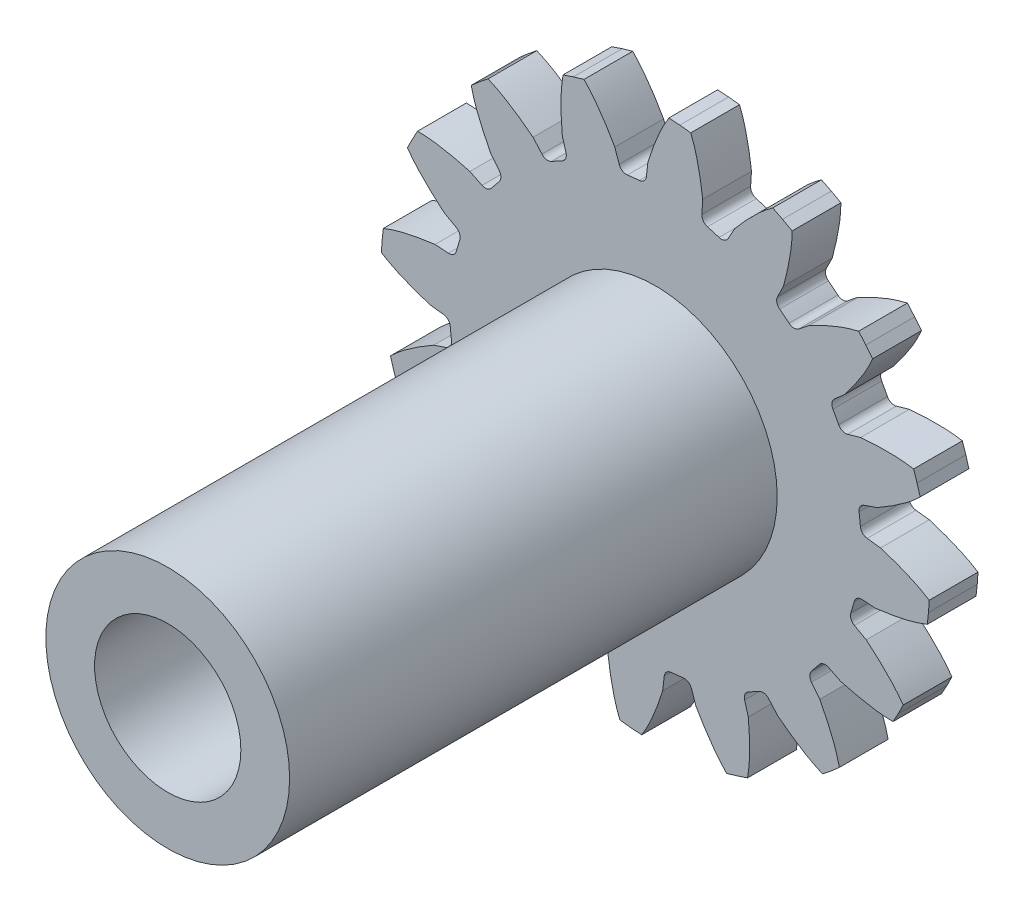
from build123d import *

# Parameters (mm, degrees)
BOSS_EXTRUDE1_DEPTH = 10
FILLET1_R           = 0.3125
SCALE1_SCALE_X      = 10
SCALE1_SCALE_Y      = 10
SCALE1_SCALE_Z      = 1
SKETCH5_R           = 50
BOSS_EXTRUDE2_DEPTH = 200
SKETCH15_R          = 30
CUT_EXTRUDE1_DEPTH  = 200


with BuildPart() as part:
    # Sketch2 → Boss-Extrude1 (new, symmetric)
    with BuildSketch(Plane.XY):
        with BuildLine():
            Line((-0.302623993, 9.238795325), (-0.396248786, 8.428190384))
            add(Edge.make_bspline(
                [(-1.398467591, 8.32079892), (-0.900663309, 8.404442545), (-0.396248786, 8.428190384)],
                knots=[0, 0, 0, 1, 1, 1], degree=2))
            Line((-1.398467591, 8.32079892), (-1.661713487, 9.093163842))
            add(Edge.make_bspline(
                [(-1.661713487, 9.093163842), (-2.020761764, 9.720213192), (-2.416112385, 10.344214849), (-2.925379163, 10.862994833)],
                knots=[0, 0, 0, 0, 1, 1, 1, 1], degree=3))
            Line((-2.925379163, 10.862994833), (-3.357860116, 10.737191227))
            Line((-3.357860116, 10.737191227), (-3.784958773, 10.594177037))
            add(Edge.make_bspline(
                [(-3.815122027, 8.419724719), (-3.877304002, 9.139613568), (-3.907915489, 9.87768072), (-3.784958773, 10.594177037)],
                knots=[0, 0, 0, 0, 1, 1, 1, 1], degree=3))
            Line((-3.815122027, 8.419724719), (-3.591414982, 7.634994744))
            add(Edge.make_bspline(
                [(-4.476247489, 7.152245434), (-4.048255538, 7.420072844), (-3.591414982, 7.634994744)],
                knots=[0, 0, 0, 1, 1, 1], degree=2))
            Line((-4.476247489, 7.152245434), (-5.015026238, 7.765077737))
            add(Edge.make_bspline(
                [(-5.015026238, 7.765077737), (-5.586438573, 8.207436933), (-6.190778664, 8.632151208), (-6.859786092, 8.916604442)],
                knots=[0, 0, 0, 0, 1, 1, 1, 1], degree=3))
            Line((-6.859786092, 8.916604442), (-7.211203432, 8.634873772))
            Line((-7.211203432, 8.634873772), (-7.551061976, 8.339302311))
            add(Edge.make_bspline(
                [(-6.746802312, 6.318827346), (-7.080223864, 6.959938712), (-7.390413769, 7.630305318), (-7.551061976, 8.339302311)],
                knots=[0, 0, 0, 0, 1, 1, 1, 1], degree=3))
            Line((-6.746802312, 6.318827346), (-6.239820787, 5.67944037))
            add(Edge.make_bspline(
                [(-6.872559268, 4.894827424), (-6.579703447, 5.305973173), (-6.239820787, 5.67944037)],
                knots=[0, 0, 0, 1, 1, 1], degree=2))
            Line((-6.872559268, 4.894827424), (-7.6048467, 5.25482894))
            add(Edge.make_bspline(
                [(-7.6048467, 5.25482894), (-8.302123015, 5.444334318), (-9.022913921, 5.606015014), (-9.749852755, 5.612741867)],
                knots=[0, 0, 0, 0, 1, 1, 1, 1], degree=3))
            Line((-9.749852755, 5.612741867), (-9.966706385, 5.217975069))
            Line((-9.966706385, 5.217975069), (-10.167584439, 4.814844409))
            add(Edge.make_bspline(
                [(-8.65134311, 3.255945788), (-9.204350686, 3.721014784), (-9.747888564, 4.221261479), (-10.167584439, 4.814844409)],
                knots=[0, 0, 0, 0, 1, 1, 1, 1], degree=3))
            Line((-8.65134311, 3.255945788), (-7.938270456, 2.85924267))
            add(Edge.make_bspline(
                [(-8.222586211, 1.892216293), (-8.10933276, 2.384234876), (-7.938270456, 2.85924267)],
                knots=[0, 0, 0, 1, 1, 1], degree=2))
            Line((-8.222586211, 1.892216293), (-9.036898195, 1.944580063))
            add(Edge.make_bspline(
                [(-9.036898195, 1.944580063), (-9.753742916, 1.853325712), (-10.481394233, 1.72631108), (-11.155592729, 1.454390203)],
                knots=[0, 0, 0, 0, 1, 1, 1, 1], degree=3))
            Line((-11.155592729, 1.454390203), (-11.204868646, 1.006686951))
            Line((-11.204868646, 1.006686951), (-11.236184343, 0.557370086))
            add(Edge.make_bspline(
                [(-9.238795342, -0.302624001), (-9.927894173, -0.085054444), (-10.621252328, 0.169628943), (-11.236184343, 0.557370086)],
                knots=[0, 0, 0, 0, 1, 1, 1, 1], degree=3))
            Line((-9.238795342, -0.302624001), (-8.428190401, -0.396248794))
            add(Edge.make_bspline(
                [(-8.320798937, -1.398467598), (-8.404442527, -0.900663312), (-8.428190401, -0.396248794)],
                knots=[0, 0, 0, 1, 1, 1], degree=2))
            Line((-8.320798937, -1.398467598), (-9.093163859, -1.661713495))
            add(Edge.make_bspline(
                [(-9.093163859, -1.661713495), (-9.720213202, -2.020761772), (-10.344214854, -2.416112389), (-10.862994833, -2.925379163)],
                knots=[0, 0, 0, 0, 1, 1, 1, 1], degree=3))
            Line((-10.862994833, -2.925379163), (-10.737191227, -3.357860116))
            Line((-10.737191227, -3.357860116), (-10.594177037, -3.784958773))
            add(Edge.make_bspline(
                [(-8.419724736, -3.815122035), (-9.13961358, -3.877304001), (-9.877680726, -3.907915488), (-10.594177037, -3.784958773)],
                knots=[0, 0, 0, 0, 1, 1, 1, 1], degree=3))
            Line((-8.419724736, -3.815122035), (-7.634994761, -3.59141499))
            add(Edge.make_bspline(
                [(-7.152245451, -4.476247497), (-7.420072829, -4.048255528), (-7.634994761, -3.59141499)],
                knots=[0, 0, 0, 1, 1, 1], degree=2))
            Line((-7.152245451, -4.476247497), (-7.765077754, -5.015026246))
            add(Edge.make_bspline(
                [(-7.765077754, -5.015026246), (-8.207436937, -5.586438584), (-8.63215121, -6.190778669), (-8.916604442, -6.859786092)],
                knots=[0, 0, 0, 0, 1, 1, 1, 1], degree=3))
            Line((-8.916604442, -6.859786092), (-8.634873772, -7.211203432))
            Line((-8.634873772, -7.211203432), (-8.339302311, -7.551061976))
            add(Edge.make_bspline(
                [(-6.318827363, -6.74680232), (-6.959938724, -7.08022387), (-7.630305324, -7.39041377), (-8.339302311, -7.551061976)],
                knots=[0, 0, 0, 0, 1, 1, 1, 1], degree=3))
            Line((-6.318827363, -6.74680232), (-5.679440387, -6.239820795))
            add(Edge.make_bspline(
                [(-4.894827441, -6.872559276), (-5.305973169, -6.579703429), (-5.679440387, -6.239820795)],
                knots=[0, 0, 0, 1, 1, 1], degree=2))
            Line((-4.894827441, -6.872559276), (-5.254828957, -7.604846708))
            add(Edge.make_bspline(
                [(-5.254828957, -7.604846708), (-5.444334315, -8.302123024), (-5.606015015, -9.022913925), (-5.612741867, -9.749852755)],
                knots=[0, 0, 0, 0, 1, 1, 1, 1], degree=3))
            Line((-5.612741867, -9.749852755), (-5.217975069, -9.966706385))
            Line((-5.217975069, -9.966706385), (-4.814844409, -10.167584439))
            add(Edge.make_bspline(
                [(-3.255945805, -8.651343118), (-3.72101479, -9.204350696), (-4.221261484, -9.747888567), (-4.814844409, -10.167584439)],
                knots=[0, 0, 0, 0, 1, 1, 1, 1], degree=3))
            Line((-3.255945805, -8.651343118), (-2.859242687, -7.938270464))
            add(Edge.make_bspline(
                [(-1.89221631, -8.222586219), (-2.384234886, -8.109332744), (-2.859242687, -7.938270464)],
                knots=[0, 0, 0, 1, 1, 1], degree=2))
            Line((-1.89221631, -8.222586219), (-1.94458008, -9.036898203))
            add(Edge.make_bspline(
                [(-1.94458008, -9.036898203), (-1.853325706, -9.753742918), (-1.72631108, -10.481394234), (-1.454390203, -11.155592729)],
                knots=[0, 0, 0, 0, 1, 1, 1, 1], degree=3))
            Line((-1.454390203, -11.155592729), (-1.006686951, -11.204868646))
            Line((-1.006686951, -11.204868646), (-0.557370086, -11.236184343))
            add(Edge.make_bspline(
                [(0.302623984, -9.23879535), (0.085054445, -9.927894182), (-0.169628946, -10.621252331), (-0.557370086, -11.236184343)],
                knots=[0, 0, 0, 0, 1, 1, 1, 1], degree=3))
            Line((0.302623984, -9.23879535), (0.396248777, -8.428190409))
            add(Edge.make_bspline(
                [(1.398467582, -8.320798945), (0.900663294, -8.404442523), (0.396248777, -8.428190409)],
                knots=[0, 0, 0, 1, 1, 1], degree=2))
            Line((1.398467582, -8.320798945), (1.661713478, -9.093163867))
            add(Edge.make_bspline(
                [(1.661713478, -9.093163867), (2.020761776, -9.720213198), (2.416112388, -10.344214853), (2.925379163, -10.862994833)],
                knots=[0, 0, 0, 0, 1, 1, 1, 1], degree=3))
            Line((2.925379163, -10.862994833), (3.357860116, -10.737191227))
            Line((3.357860116, -10.737191227), (3.784958773, -10.594177037))
            add(Edge.make_bspline(
                [(3.815122018, -8.419724743), (3.877304006, -9.139613584), (3.907915487, -9.877680728), (3.784958773, -10.594177037)],
                knots=[0, 0, 0, 0, 1, 1, 1, 1], degree=3))
            Line((3.815122018, -8.419724743), (3.591414973, -7.634994769))
            add(Edge.make_bspline(
                [(4.47624748, -7.152245459), (4.048255513, -7.420072838), (3.591414973, -7.634994769)],
                knots=[0, 0, 0, 1, 1, 1], degree=2))
            Line((4.47624748, -7.152245459), (5.015026229, -7.765077762))
            add(Edge.make_bspline(
                [(5.015026229, -7.765077762), (5.586438582, -8.207436929), (6.190778666, -8.63215121), (6.859786092, -8.916604442)],
                knots=[0, 0, 0, 0, 1, 1, 1, 1], degree=3))
            Line((6.859786092, -8.916604442), (7.211203432, -8.634873772))
            Line((7.211203432, -8.634873772), (7.551061976, -8.339302311))
            add(Edge.make_bspline(
                [(6.746802303, -6.318827371), (7.080223876, -6.959938721), (7.39041377, -7.630305325), (7.551061976, -8.339302311)],
                knots=[0, 0, 0, 0, 1, 1, 1, 1], degree=3))
            Line((6.746802303, -6.318827371), (6.239820778, -5.679440395))
            add(Edge.make_bspline(
                [(6.872559259, -4.894827449), (6.579703425, -5.305973187), (6.239820778, -5.679440395)],
                knots=[0, 0, 0, 1, 1, 1], degree=2))
            Line((6.872559259, -4.894827449), (7.604846691, -5.254828965))
            add(Edge.make_bspline(
                [(7.604846691, -5.254828965), (8.302123015, -5.444334309), (9.02291392, -5.606015015), (9.749852755, -5.612741867)],
                knots=[0, 0, 0, 0, 1, 1, 1, 1], degree=3))
            Line((9.749852755, -5.612741867), (9.966706385, -5.217975069))
            Line((9.966706385, -5.217975069), (10.167584439, -4.814844409))
            add(Edge.make_bspline(
                [(8.651343102, -3.255945813), (9.204350697, -3.721014782), (9.747888565, -4.221261482), (10.167584439, -4.814844409)],
                knots=[0, 0, 0, 0, 1, 1, 1, 1], degree=3))
            Line((8.651343102, -3.255945813), (7.938270447, -2.859242695))
            add(Edge.make_bspline(
                [(8.222586202, -1.892216318), (8.109332754, -2.384234902), (7.938270447, -2.859242695)],
                knots=[0, 0, 0, 1, 1, 1], degree=2))
            Line((8.222586202, -1.892216318), (9.036898186, -1.944580088))
            add(Edge.make_bspline(
                [(9.036898186, -1.944580088), (9.753742906, -1.853325706), (10.481394229, -1.726311082), (11.155592729, -1.454390203)],
                knots=[0, 0, 0, 0, 1, 1, 1, 1], degree=3))
            Line((11.155592729, -1.454390203), (11.204868646, -1.006686951))
            Line((11.204868646, -1.006686951), (11.236184343, -0.557370086))
            add(Edge.make_bspline(
                [(9.238795333, 0.302623976), (9.927894175, 0.085054452), (10.621252327, -0.169628944), (11.236184343, -0.557370086)],
                knots=[0, 0, 0, 0, 1, 1, 1, 1], degree=3))
            Line((9.238795333, 0.302623976), (8.428190392, 0.396248769))
            add(Edge.make_bspline(
                [(8.320798928, 1.398467574), (8.404442541, 0.90066329), (8.428190392, 0.396248769)],
                knots=[0, 0, 0, 1, 1, 1], degree=2))
            Line((8.320798928, 1.398467574), (9.09316385, 1.66171347))
            add(Edge.make_bspline(
                [(9.09316385, 1.66171347), (9.720213187, 2.020761769), (10.344214849, 2.416112384), (10.862994833, 2.925379163)],
                knots=[0, 0, 0, 0, 1, 1, 1, 1], degree=3))
            Line((10.862994833, 2.925379163), (10.737191227, 3.357860116))
            Line((10.737191227, 3.357860116), (10.594177037, 3.784958773))
            add(Edge.make_bspline(
                [(8.419724727, 3.81512201), (9.139613573, 3.877304008), (9.877680722, 3.907915488), (10.594177037, 3.784958773)],
                knots=[0, 0, 0, 0, 1, 1, 1, 1], degree=3))
            Line((8.419724727, 3.81512201), (7.634994752, 3.591414965))
            add(Edge.make_bspline(
                [(7.152245442, 4.476247472), (7.420072854, 4.048255523), (7.634994752, 3.591414965)],
                knots=[0, 0, 0, 1, 1, 1], degree=2))
            Line((7.152245442, 4.476247472), (7.765077745, 5.015026221))
            add(Edge.make_bspline(
                [(7.765077745, 5.015026221), (8.207436925, 5.586438571), (8.632151207, 6.190778661), (8.916604442, 6.859786092)],
                knots=[0, 0, 0, 0, 1, 1, 1, 1], degree=3))
            Line((8.916604442, 6.859786092), (8.634873772, 7.211203432))
            Line((8.634873772, 7.211203432), (8.339302311, 7.551061976))
            add(Edge.make_bspline(
                [(6.318827354, 6.746802295), (6.95993871, 7.08022387), (7.630305319, 7.390413768), (8.339302311, 7.551061976)],
                knots=[0, 0, 0, 0, 1, 1, 1, 1], degree=3))
            Line((6.318827354, 6.746802295), (5.679440378, 6.23982077))
            add(Edge.make_bspline(
                [(4.894827432, 6.872559251), (5.305973191, 6.579703443), (5.679440378, 6.23982077)],
                knots=[0, 0, 0, 1, 1, 1], degree=2))
            Line((4.894827432, 6.872559251), (5.254828948, 7.604846683))
            add(Edge.make_bspline(
                [(5.254828948, 7.604846683), (5.444334312, 8.302123007), (5.606015014, 9.022913916), (5.612741867, 9.749852755)],
                knots=[0, 0, 0, 0, 1, 1, 1, 1], degree=3))
            Line((5.612741867, 9.749852755), (5.217975069, 9.966706385))
            Line((5.217975069, 9.966706385), (4.814844409, 10.167584439))
            add(Edge.make_bspline(
                [(3.255945796, 8.651343094), (3.721014776, 9.204350686), (4.221261477, 9.747888562), (4.814844409, 10.167584439)],
                knots=[0, 0, 0, 0, 1, 1, 1, 1], degree=3))
            Line((3.255945796, 8.651343094), (2.859242678, 7.938270439))
            add(Edge.make_bspline(
                [(1.892216301, 8.222586194), (2.384234892, 8.10933277), (2.859242678, 7.938270439)],
                knots=[0, 0, 0, 1, 1, 1], degree=2))
            Line((1.892216301, 8.222586194), (1.944580071, 9.036898178))
            add(Edge.make_bspline(
                [(1.944580071, 9.036898178), (1.853325712, 9.753742904), (1.726311082, 10.481394227), (1.454390203, 11.155592729)],
                knots=[0, 0, 0, 0, 1, 1, 1, 1], degree=3))
            Line((1.454390203, 11.155592729), (1.006686951, 11.204868646))
            Line((1.006686951, 11.204868646), (0.557370086, 11.236184343))
            add(Edge.make_bspline(
                [(-0.302623993, 9.238795325), (-0.08505445, 9.927894166), (0.169628941, 10.621252324), (0.557370086, 11.236184343)],
                knots=[0, 0, 0, 0, 1, 1, 1, 1], degree=3))
        make_face()
    extrude(amount=BOSS_EXTRUDE1_DEPTH, both=True)

    # Fillet1
    fillet1_edges = [part.edges().sort_by_distance(p)[0] for p in [
        (-0.396248786, 8.428190384, -5),
        (-1.398467591, 8.32079892, -5),
        (-3.591414982, 7.634994744, 5),
        (-4.476247489, 7.152245434, -5),
        (-6.239820787, 5.67944037, 5),
        (-6.872559268, 4.894827424, -5),
        (-7.938270456, 2.85924267, 5),
        (-8.222586211, 1.892216293, -5),
        (-8.428190401, -0.396248794, 5),
        (-8.320798937, -1.398467598, -5),
        (-7.634994761, -3.59141499, 5),
        (-7.152245451, -4.476247497, -5),
        (-5.679440387, -6.239820795, 5),
        (-4.894827441, -6.872559276, -5),
        (-2.859242687, -7.938270464, 5),
        (-1.89221631, -8.222586219, -5),
        (0.396248777, -8.428190409, 5),
        (1.398467582, -8.320798945, -5),
        (3.591414973, -7.634994769, 5),
        (4.47624748, -7.152245459, -5),
        (6.239820778, -5.679440395, 5),
        (6.872559259, -4.894827449, -5),
        (7.938270447, -2.859242695, 5),
        (8.222586202, -1.892216318, -5),
        (8.428190392, 0.396248769, 5),
        (8.320798928, 1.398467574, -5),
        (7.634994752, 3.591414965, 5),
        (7.152245442, 4.476247472, -5),
        (4.894827432, 6.872559251, -5),
        (5.679440378, 6.23982077, 5),
        (1.892216301, 8.222586194, -5),
        (2.859242678, 7.938270439, 5),
    ]]
    fillet(fillet1_edges, radius=FILLET1_R)


with BuildPart() as part_1:
    # Scale1: scaled about (0, 0, 0)
    add(part.part.scale((SCALE1_SCALE_X, SCALE1_SCALE_Y, SCALE1_SCALE_Z), about=(0, 0, 0)))

    # Sketch5 → Boss-Extrude2 (add)
    with BuildSketch(Plane.XY.offset(10)):
        Circle(SKETCH5_R)
    extrude(amount=BOSS_EXTRUDE2_DEPTH)

    # Sketch15 → Cut-Extrude1 (cut)
    with BuildSketch(Plane.XY.offset(210)):
        Circle(SKETCH15_R)
    extrude(amount=-CUT_EXTRUDE1_DEPTH, mode=Mode.SUBTRACT)


solid = part_1.part
